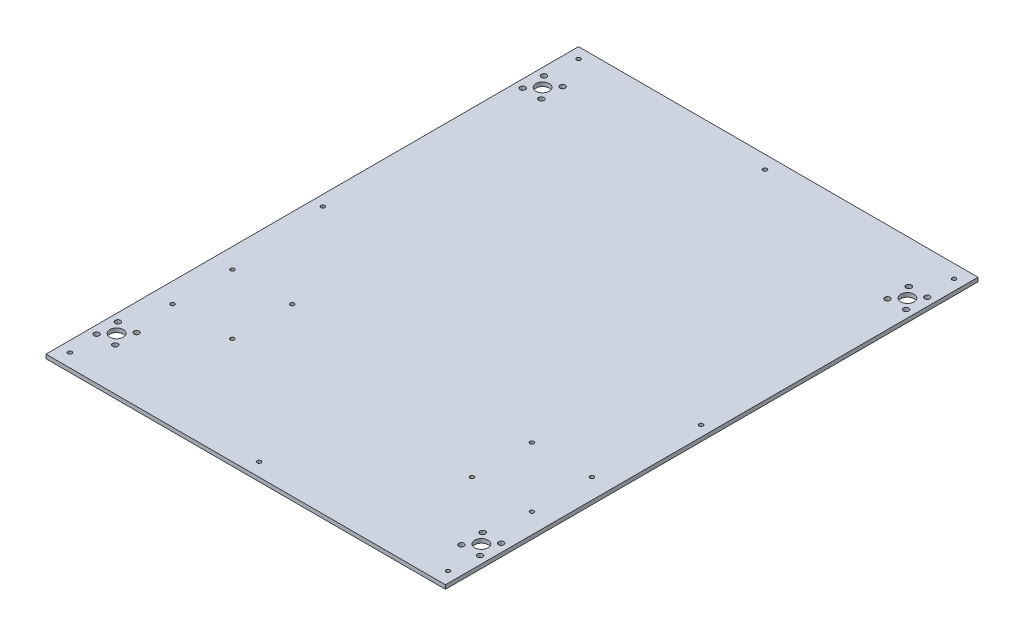
from build123d import *

# Parameters (mm, degrees)
SKETCH_1_W          = 300
SKETCH_1_H          = 400
SKETCH_1_R          = 5
SKETCH_1_R_2        = 2
EXTRUDE_1_DEPTH     = 3
SKETCH_4_R          = 1.5
CUT_EXTRUDE_1_DEPTH = 251.017999352
SKETCH_5_R          = 1.5
CUT_EXTRUDE_2_DEPTH = 10


with BuildPart() as part:
    # 草图1 → 凸台-拉伸1 (new body)
    with BuildSketch(Plane(origin=(0, 0, 0), x_dir=(1, 0, 0), z_dir=(0, 1, 0))):
        Rectangle(SKETCH_1_W, SKETCH_1_H)
        with Locations(Location((-137, 160, 0), (0, 0, 270))):
            Circle(SKETCH_1_R, mode=Mode.SUBTRACT)
        with Locations(Location((137, 160, 0), (0, 0, 270))):
            Circle(SKETCH_1_R, mode=Mode.SUBTRACT)
        with Locations(Location((137, -160, 0), (0, 0, 270))):
            Circle(SKETCH_1_R, mode=Mode.SUBTRACT)
        with Locations(Location((-137, -160, 0), (0, 0, 270))):
            Circle(SKETCH_1_R, mode=Mode.SUBTRACT)
        with Locations(Location((-144, 168, 0), (0, 0, 270))):
            Circle(SKETCH_1_R_2, mode=Mode.SUBTRACT)
        with Locations(Location((-130, 168, 0), (0, 0, 270))):
            Circle(SKETCH_1_R_2, mode=Mode.SUBTRACT)
        with Locations(Location((-130, 152, 0), (0, 0, 270))):
            Circle(SKETCH_1_R_2, mode=Mode.SUBTRACT)
        with Locations(Location((-144, 152, 0), (0, 0, 270))):
            Circle(SKETCH_1_R_2, mode=Mode.SUBTRACT)
        with Locations(Location((130, 152, 0), (0, 0, 90))):
            Circle(SKETCH_1_R_2, mode=Mode.SUBTRACT)
        with Locations(Location((144, 152, 0), (0, 0, 90))):
            Circle(SKETCH_1_R_2, mode=Mode.SUBTRACT)
        with Locations(Location((130, 168, 0), (0, 0, 90))):
            Circle(SKETCH_1_R_2, mode=Mode.SUBTRACT)
        with Locations(Location((144, 168, 0), (0, 0, 90))):
            Circle(SKETCH_1_R_2, mode=Mode.SUBTRACT)
        with Locations(Location((144, -152, 0), (0, 0, 270))):
            Circle(SKETCH_1_R_2, mode=Mode.SUBTRACT)
        with Locations(Location((130, -152, 0), (0, 0, 270))):
            Circle(SKETCH_1_R_2, mode=Mode.SUBTRACT)
        with Locations(Location((144, -168, 0), (0, 0, 270))):
            Circle(SKETCH_1_R_2, mode=Mode.SUBTRACT)
        with Locations(Location((130, -168, 0), (0, 0, 270))):
            Circle(SKETCH_1_R_2, mode=Mode.SUBTRACT)
        with Locations(Location((-144, -152, 0), (0, 0, 90))):
            Circle(SKETCH_1_R_2, mode=Mode.SUBTRACT)
        with Locations(Location((-130, -152, 0), (0, 0, 90))):
            Circle(SKETCH_1_R_2, mode=Mode.SUBTRACT)
        with Locations(Location((-130, -168, 0), (0, 0, 90))):
            Circle(SKETCH_1_R_2, mode=Mode.SUBTRACT)
        with Locations(Location((-144, -168, 0), (0, 0, 90))):
            Circle(SKETCH_1_R_2, mode=Mode.SUBTRACT)
    extrude(amount=EXTRUDE_1_DEPTH)

    # 草图4 → 切除-拉伸1 (cut, through all)
    with BuildSketch(Plane(origin=(0, 3, 0), x_dir=(1, 0, 0), z_dir=(0, 1, 0))):
        with Locations(Location((-142, -190, 0), (0, 0, 270))):
            Circle(SKETCH_4_R)
        with Locations(Location((142, -190, 0), (0, 0, 270))):
            Circle(SKETCH_4_R)
        with Locations(Location((142, 0, 0), (0, 0, 270))):
            Circle(SKETCH_4_R)
        with Locations(Location((-142, 0, 0), (0, 0, 270))):
            Circle(SKETCH_4_R)
        with Locations(Location((-142, 192, 0), (0, 0, 270))):
            Circle(SKETCH_4_R)
        with Locations(Location((142, 190, 0), (0, 0, 270))):
            Circle(SKETCH_4_R)
        with Locations(Location((0, 190, 0), (0, 0, 270))):
            Circle(SKETCH_4_R)
        with Locations(Location((0, -190, 0), (0, 0, 270))):
            Circle(SKETCH_4_R)
    extrude(amount=-CUT_EXTRUDE_1_DEPTH, mode=Mode.SUBTRACT)

    # 草图5 → 切除-拉伸2 (cut)
    with BuildSketch(Plane.XZ):
        with Locations(Location((-135, 120, 0), (0, 0, 270))):
            Circle(SKETCH_5_R)
        with Locations(Location((-90, 120, 0), (0, 0, 270))):
            Circle(SKETCH_5_R)
        with Locations(Location((-135, 75, 0), (0, 0, 270))):
            Circle(SKETCH_5_R)
        with Locations(Location((-90, 75, 0), (0, 0, 270))):
            Circle(SKETCH_5_R)
        with Locations(Location((90, 75, 0), (0, 0, 90))):
            Circle(SKETCH_5_R)
        with Locations(Location((135, 75, 0), (0, 0, 90))):
            Circle(SKETCH_5_R)
        with Locations(Location((90, 120, 0), (0, 0, 90))):
            Circle(SKETCH_5_R)
        with Locations(Location((135, 120, 0), (0, 0, 90))):
            Circle(SKETCH_5_R)
    extrude(amount=-CUT_EXTRUDE_2_DEPTH, mode=Mode.SUBTRACT)


solid = part.part
